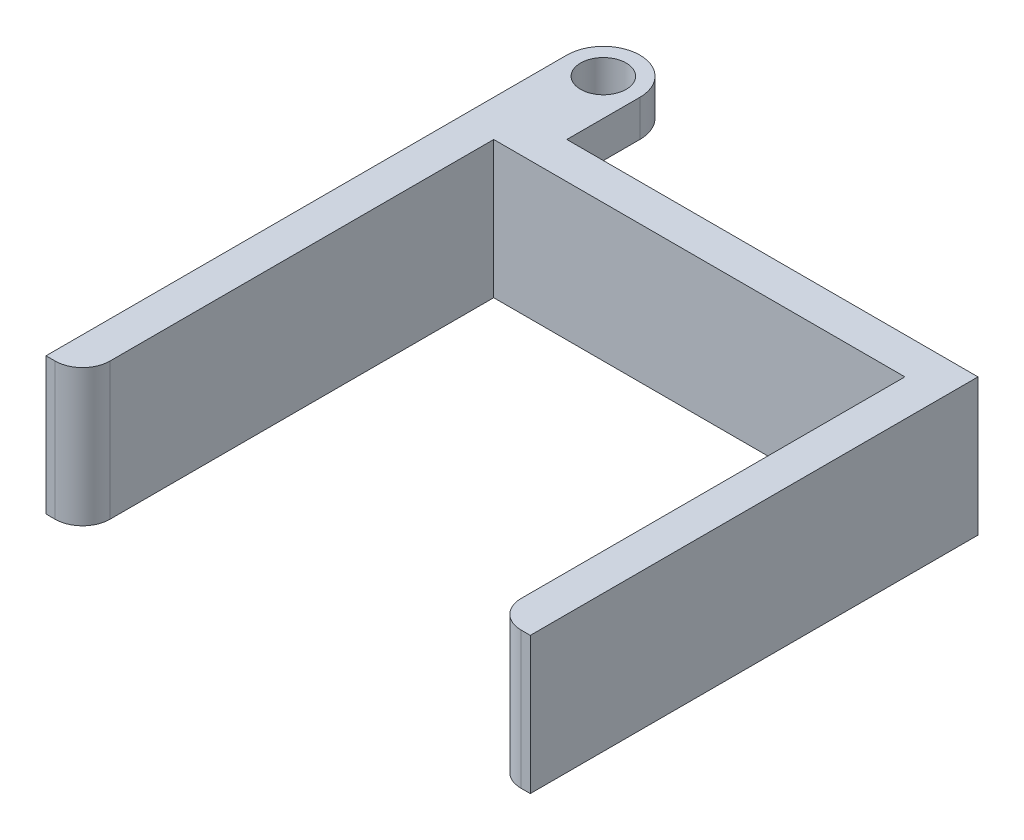
from build123d import *

# Parameters (mm, degrees)
BOSS_EXTRUDE1_DEPTH = 15
FILLET1_R           = 3
SKETCH2_R           = 2.5
BOSS_EXTRUDE2_DEPTH = 4


with BuildPart() as part:
    # Sketch1 → Boss-Extrude1 (new body)
    with BuildSketch(Plane(origin=(0, 0, 0), x_dir=(1, 0, 0), z_dir=(0, 1, 0))):
        Polygon((-26.5, 26.5), (-26.5, -22.5), (-22.5, -22.5), (-22.5, 22.5), (22.5, 22.5), (22.5, -22.5), (26.5, -22.5), (26.5, 26.5), align=None)
    extrude(amount=BOSS_EXTRUDE1_DEPTH)

    # Fillet1
    fillet1_edges = [part.edges().sort_by_distance(p)[0] for p in [
        (22.5, 7.5, 22.5),
        (-22.5, 7.5, 22.5),
    ]]
    fillet(fillet1_edges, radius=FILLET1_R)

    # Sketch2 → Boss-Extrude2 (add)
    with BuildSketch(Plane(origin=(0, 15, 0), x_dir=(1, 0, 0), z_dir=(0, 1, 0))):
        with BuildLine():
            ThreePointArc((-18.5, 34.5), (-22.5, 38.5), (-26.5, 34.5))
            Line((-26.5, 34.5), (-26.5, 26.5))
            Line((-26.5, 26.5), (-18.5, 26.5))
            Line((-18.5, 26.5), (-18.5, 34.5))
        make_face()
        with Locations((-22.5, 34.5)):
            Circle(SKETCH2_R, mode=Mode.SUBTRACT)
    extrude(amount=-BOSS_EXTRUDE2_DEPTH)


solid = part.part
